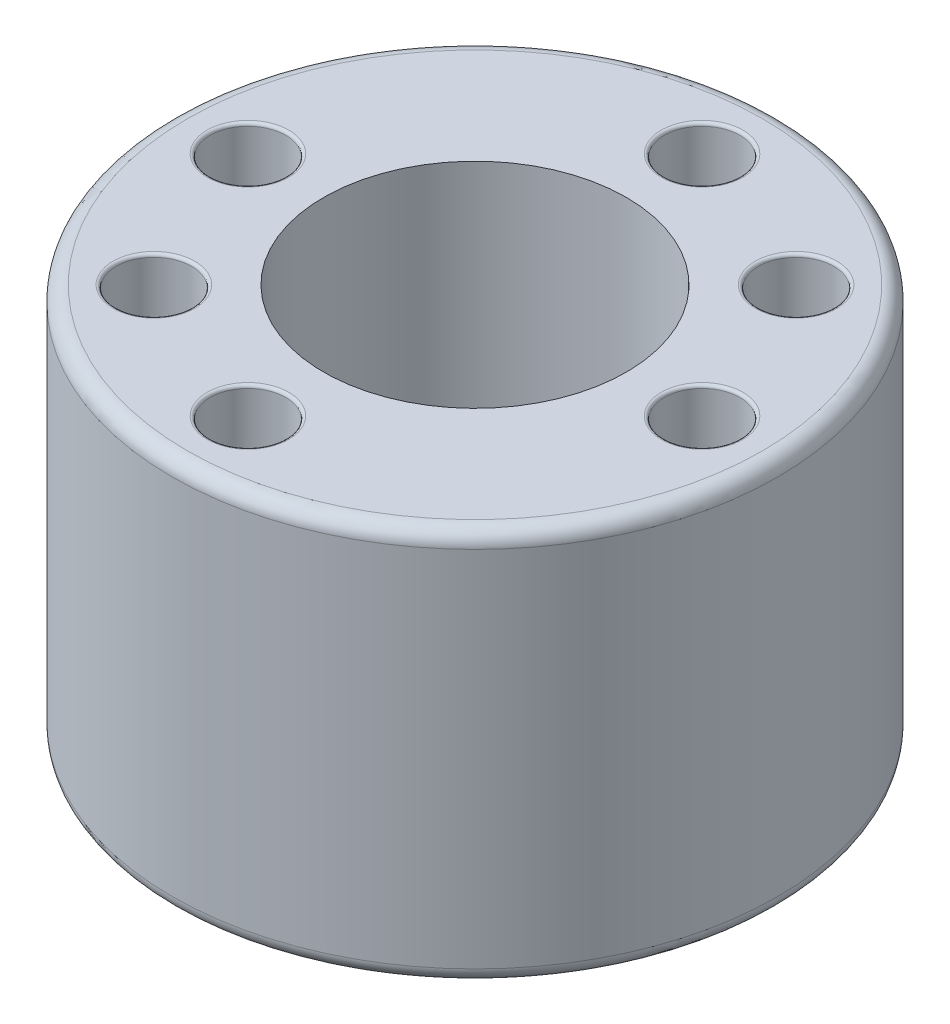
from build123d import *

# Parameters (mm, degrees)
SKETCH1_R           = 10
SKETCH1_R_2         = 5
BOSS_EXTRUDE1_DEPTH = 13
SKETCH2_R           = 1.25
CUT_EXTRUDE1_DEPTH  = 12
FILLET1_R           = 0.5
FILLET2_R           = 0.1


with BuildPart() as part:
    # Sketch1 → Boss-Extrude1 (new body)
    with BuildSketch(Plane(origin=(0, 0, 0), x_dir=(1, 0, 0), z_dir=(0, 1, 0))):
        with Locations(Location((0, 0, 0), (0, 0, 90))):
            Circle(SKETCH1_R)
        with Locations(Location((0, 0, 0), (0, 0, 90))):
            Circle(SKETCH1_R_2, mode=Mode.SUBTRACT)
    extrude(amount=BOSS_EXTRUDE1_DEPTH)

    # Sketch2 → Cut-Extrude1 (cut)
    with BuildSketch(Plane(origin=(0, 13, 0), x_dir=(1, 0, 0), z_dir=(0, 1, 0))):
        with Locations(Location((0, 7.5, 0), (0, 0, 270))):
            Circle(SKETCH2_R)
        with Locations(Location((7.5, 0, 0), (0, 0, 270))):
            Circle(SKETCH2_R)
        with Locations(Location((0, -7.5, 0), (0, 0, 270))):
            Circle(SKETCH2_R)
        with Locations(Location((-7.5, 0, 0), (0, 0, 270))):
            Circle(SKETCH2_R)
        with Locations(Location((5.303300859, 5.303300859, 0), (0, 0, 270))):
            Circle(SKETCH2_R)
        with Locations(Location((-5.303300859, -5.303300859, 0), (0, 0, 90))):
            Circle(SKETCH2_R)
    extrude(amount=-CUT_EXTRUDE1_DEPTH, mode=Mode.SUBTRACT)

    # Fillet1
    fillet1_edges = [part.edges().sort_by_distance(p)[0] for p in [
        (0, 0, 10),
        (0, 13, 10),
    ]]
    fillet(fillet1_edges, radius=FILLET1_R)

    # Fillet2
    fillet2_edges = [part.edges().sort_by_distance(p)[0] for p in [
        (5.303300859, 13, -6.553300859),
        (-7.5, 13, -1.25),
        (0, 13, 6.25),
        (7.5, 13, -1.25),
        (-5.303300859, 13, 6.553300859),
        (0, 13, -8.75),
    ]]
    fillet(fillet2_edges, radius=FILLET2_R)


solid = part.part
